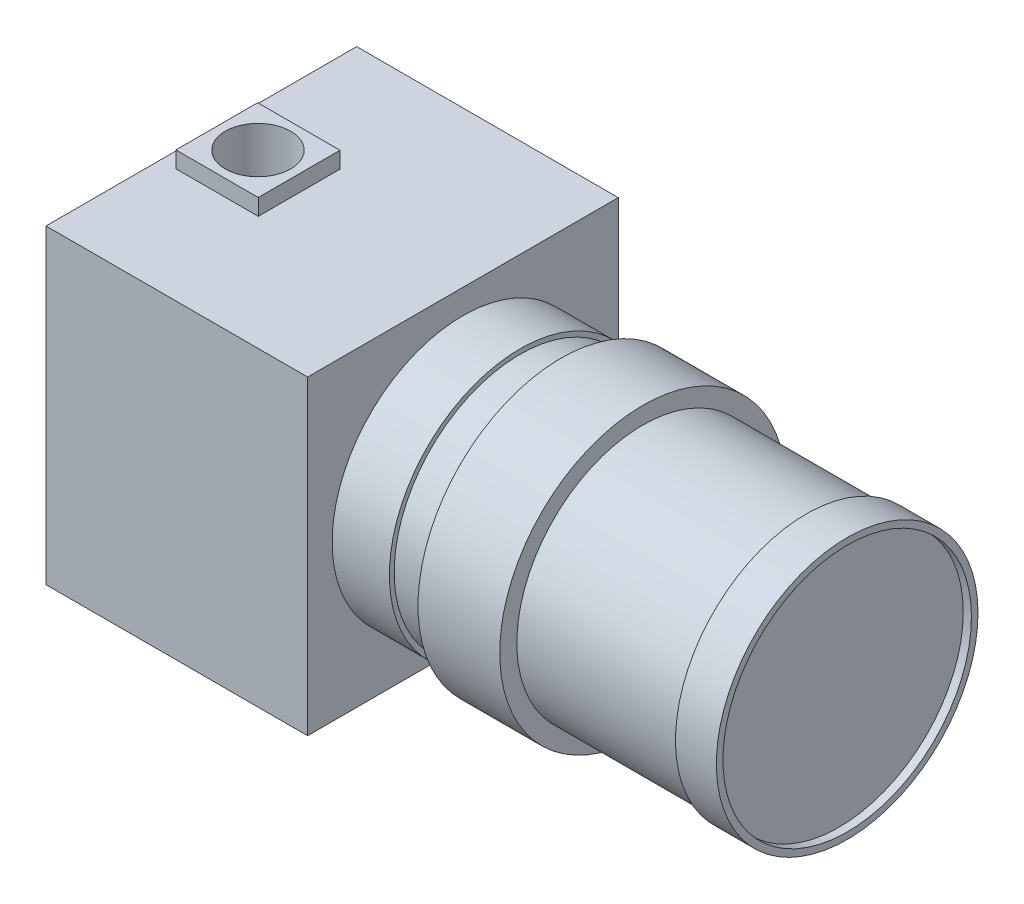
from build123d import *

# Parameters (mm, degrees)
SKETCH1_W           = 38
SKETCH1_H           = 38
BOSS_EXTRUDE1_DEPTH = 32
SKETCH2_R           = 16
BOSS_EXTRUDE2_DEPTH = 47
SKETCH3_W           = 10.074074074
SKETCH3_H           = 10
SKETCH3_R           = 4
BOSS_EXTRUDE3_DEPTH = 2
CUT_EXTRUDE1_START  = -5
SKETCH3_2_R         = 4
CUT_EXTRUDE1_DEPTH  = 5
CUT_EXTRUDE2_START  = -25
SKETCH4_R           = 16
SKETCH4_R_2         = 15.412875145
CUT_EXTRUDE2_DEPTH  = 20
BOSS_EXTRUDE4_START = -35
SKETCH5_R           = 17.5
SKETCH5_R_2         = 16
BOSS_EXTRUDE4_DEPTH = 10
CUT_EXTRUDE3_START  = -40
SKETCH4_2_R         = 16
SKETCH4_2_R_2       = 15.412875145
CUT_EXTRUDE3_DEPTH  = 5
SKETCH6_R           = 15.197678489
CUT_EXTRUDE4_DEPTH  = 1


with BuildPart() as part:
    # Sketch1 → Boss-Extrude1 (new body)
    with BuildSketch(Plane(origin=(0, 0, 0), x_dir=(0, 0, -1), z_dir=(1, 0, 0))):
        Rectangle(SKETCH1_W, SKETCH1_H)
    extrude(amount=BOSS_EXTRUDE1_DEPTH)

    # Sketch2 → Boss-Extrude2 (add)
    with BuildSketch(Plane(origin=(32, 0, 0), x_dir=(0, 0, -1), z_dir=(1, 0, 0))):
        Circle(SKETCH2_R)
    extrude(amount=BOSS_EXTRUDE2_DEPTH)

    # Sketch3 → Boss-Extrude3 (add)
    with BuildSketch(Plane(origin=(0, 19, 0), x_dir=(1, 0, 0), z_dir=(0, 1, 0))):
        with Locations((6.924898334, 0)):
            Rectangle(SKETCH3_W, SKETCH3_H)
        with Locations((6.924898334, 0)):
            Circle(SKETCH3_R, mode=Mode.SUBTRACT)
    extrude(amount=BOSS_EXTRUDE3_DEPTH)

    # Sketch3<2> → Cut-Extrude1 (cut)
    with BuildSketch(Plane(origin=(0, 19, 0), x_dir=(1, 0, 0), z_dir=(0, 1, 0)).offset(CUT_EXTRUDE1_START)):
        with Locations((6.924898334, 0)):
            Circle(SKETCH3_2_R)
    extrude(amount=CUT_EXTRUDE1_DEPTH, mode=Mode.SUBTRACT)

    # Sketch4 → Cut-Extrude2 (cut)
    with BuildSketch(Plane(origin=(79, 0, 0), x_dir=(0, 0, -1), z_dir=(1, 0, 0)).offset(CUT_EXTRUDE2_START)):
        Circle(SKETCH4_R)
        Circle(SKETCH4_R_2, mode=Mode.SUBTRACT)
    extrude(amount=CUT_EXTRUDE2_DEPTH, mode=Mode.SUBTRACT)

    # Sketch5 → Boss-Extrude4 (add)
    with BuildSketch(Plane(origin=(79, 0, 0), x_dir=(0, 0, -1), z_dir=(1, 0, 0)).offset(BOSS_EXTRUDE4_START)):
        Circle(SKETCH5_R)
        Circle(SKETCH5_R_2, mode=Mode.SUBTRACT)
    extrude(amount=BOSS_EXTRUDE4_DEPTH)

    # Sketch4<2> → Cut-Extrude3 (cut)
    with BuildSketch(Plane(origin=(79, 0, 0), x_dir=(0, 0, -1), z_dir=(1, 0, 0)).offset(CUT_EXTRUDE3_START)):
        Circle(SKETCH4_2_R)
        Circle(SKETCH4_2_R_2, mode=Mode.SUBTRACT)
    extrude(amount=CUT_EXTRUDE3_DEPTH, mode=Mode.SUBTRACT)

    # Sketch6 → Cut-Extrude4 (cut)
    with BuildSketch(Plane(origin=(79, 0, 0), x_dir=(0, 0, -1), z_dir=(1, 0, 0))):
        Circle(SKETCH6_R)
    extrude(amount=-CUT_EXTRUDE4_DEPTH, mode=Mode.SUBTRACT)


solid = part.part
